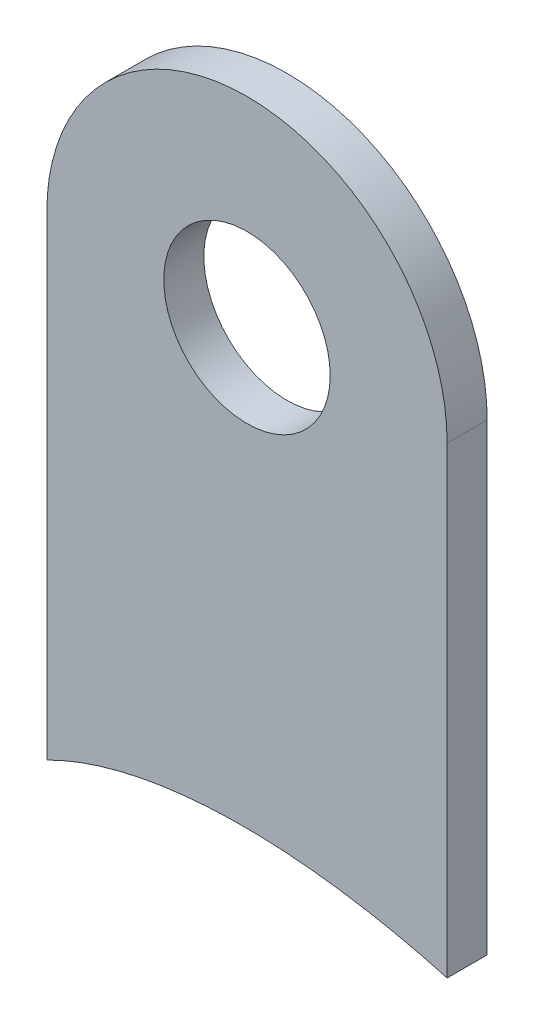
from build123d import *

# Parameters (mm, degrees)
SKETCH1_R            = 7.9375
SKETCH1_R_2          = 3
BOSS_EXTRUDE1_DEPTH  = 1.5875
M6_CLEARANCE_HOLE1_D = 6.6
SKETCH5_W            = 15.875
SKETCH5_H            = 6.35
CUT_EXTRUDE2_DEPTH   = 27.658658303
CUT_EXTRUDE3_DEPTH   = 21.698467637


with BuildPart() as part:
    # Sketch1 → Boss-Extrude1 (new body)
    # profile 1 of 3: a face of its own
    with BuildSketch(Plane.XY):
        Circle(SKETCH1_R)
        Circle(SKETCH1_R_2, mode=Mode.SUBTRACT)
    # profile 2 of 3: a face of its own
    with BuildSketch(Plane.XY):
        with BuildLine():
            ThreePointArc((7.9375, 0), (0, -7.9375), (-7.9375, 0))
            Line((-7.9375, 0), (-7.9375, -25.4))
            Line((-7.9375, -25.4), (7.9375, -25.4))
            Line((7.9375, -25.4), (7.9375, 0))
        make_face()
    # profile 3 of 3: a face of its own
    with BuildSketch(Plane.XY):
        Circle(SKETCH1_R_2)
    extrude(amount=BOSS_EXTRUDE1_DEPTH)

    # M6 Clearance Hole1 (through all)
    with Locations(Plane.XY.offset(1.5875)):
        with Locations((0, 0)):
            Hole(M6_CLEARANCE_HOLE1_D / 2)

    # Sketch5 → Cut-Extrude2 (cut, through all)
    with BuildSketch(Plane.XY.offset(1.5875)):
        with Locations((0, -22.225)):
            Rectangle(SKETCH5_W, SKETCH5_H)
    extrude(amount=-CUT_EXTRUDE2_DEPTH, mode=Mode.SUBTRACT)

    # Sketch6 → Cut-Extrude3 (cut, through all)
    with BuildSketch(Plane(origin=(0, 0, 0), x_dir=(-1, 0, 0), z_dir=(0, 0, -1))):
        with BuildLine():
            add(Edge.make_bspline(
                [(12.030285896, -22.899436183), (1.652467131, 0.283766307), (-38.284264846, -17.593667439), (-27.906446081, -40.776869929), (-17.528627316, -63.960072418), (22.408104661, -46.082638673), (12.030285896, -22.899436183)],
                knots=[0, 0, 0, 0, 0.5, 0.5, 0.5, 1, 1, 1, 1], degree=3, weights=[1, 0.333333333, 0.333333333, 1, 0.333333333, 0.333333333, 1]))
        make_face()
    extrude(amount=-CUT_EXTRUDE3_DEPTH, mode=Mode.SUBTRACT)


solid = part.part
